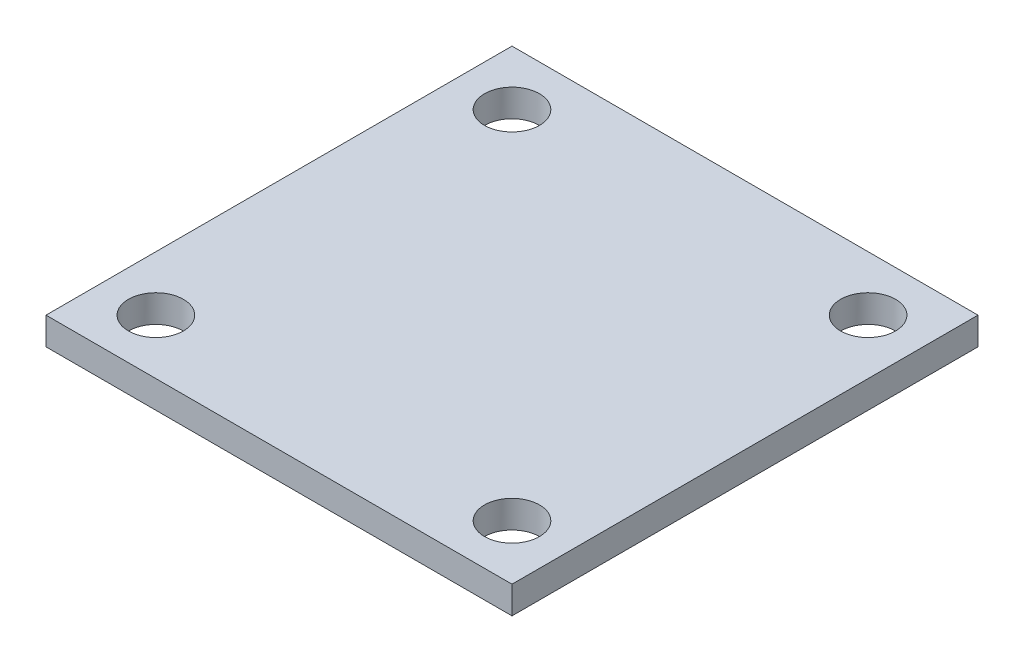
from build123d import *

# Parameters (mm, degrees)
SKETCH1_W           = 26.924
SKETCH1_H           = 26.924
BOSS_EXTRUDE1_DEPTH = 1.5875
CUT_EXTRUDE1_REACH  = 21.104
SKETCH2_R           = 1.5875


with BuildPart() as part:
    # Sketch1 → Boss-Extrude1 (new body)
    with BuildSketch(Plane(origin=(0, 0, 0), x_dir=(1, 0, 0), z_dir=(0, 1, 0))):
        Rectangle(SKETCH1_W, SKETCH1_H)
    extrude(amount=BOSS_EXTRUDE1_DEPTH)

    # Sketch2 → Cut-Extrude1 (cut, up to next)
    with BuildSketch(Plane(origin=(0, 1.5875, 0), x_dir=(1, 0, 0), z_dir=(0, 1, 0)), mode=Mode.PRIVATE) as cut_extrude1_sk1:
        with Locations((10.287, -10.287)):
            Circle(SKETCH2_R)
    cut_extrude1_tool1 = extrude(cut_extrude1_sk1.sketch, amount=-CUT_EXTRUDE1_REACH, mode=Mode.PRIVATE) & part.part
    # Sketch2 → Cut-Extrude1 (cut, up to next)
    with BuildSketch(Plane(origin=(0, 1.5875, 0), x_dir=(1, 0, 0), z_dir=(0, 1, 0)), mode=Mode.PRIVATE) as cut_extrude1_sk2:
        with Locations((10.287, 10.287)):
            Circle(SKETCH2_R)
    cut_extrude1_tool2 = extrude(cut_extrude1_sk2.sketch, amount=-CUT_EXTRUDE1_REACH, mode=Mode.PRIVATE) & part.part
    # Sketch2 → Cut-Extrude1 (cut, up to next)
    with BuildSketch(Plane(origin=(0, 1.5875, 0), x_dir=(1, 0, 0), z_dir=(0, 1, 0)), mode=Mode.PRIVATE) as cut_extrude1_sk3:
        with Locations((-10.287, -10.287)):
            Circle(SKETCH2_R)
    cut_extrude1_tool3 = extrude(cut_extrude1_sk3.sketch, amount=-CUT_EXTRUDE1_REACH, mode=Mode.PRIVATE) & part.part
    # Sketch2 → Cut-Extrude1 (cut, up to next)
    with BuildSketch(Plane(origin=(0, 1.5875, 0), x_dir=(1, 0, 0), z_dir=(0, 1, 0)), mode=Mode.PRIVATE) as cut_extrude1_sk4:
        with Locations((-10.287, 10.287)):
            Circle(SKETCH2_R)
    cut_extrude1_tool4 = extrude(cut_extrude1_sk4.sketch, amount=-CUT_EXTRUDE1_REACH, mode=Mode.PRIVATE) & part.part
    add(cut_extrude1_tool1.solids().sort_by_distance((10.287, 1.5875, 10.287))[0], mode=Mode.SUBTRACT)
    add(cut_extrude1_tool2.solids().sort_by_distance((10.287, 1.5875, -10.287))[0], mode=Mode.SUBTRACT)
    add(cut_extrude1_tool3.solids().sort_by_distance((-10.287, 1.5875, 10.287))[0], mode=Mode.SUBTRACT)
    add(cut_extrude1_tool4.solids().sort_by_distance((-10.287, 1.5875, -10.287))[0], mode=Mode.SUBTRACT)


solid = part.part
